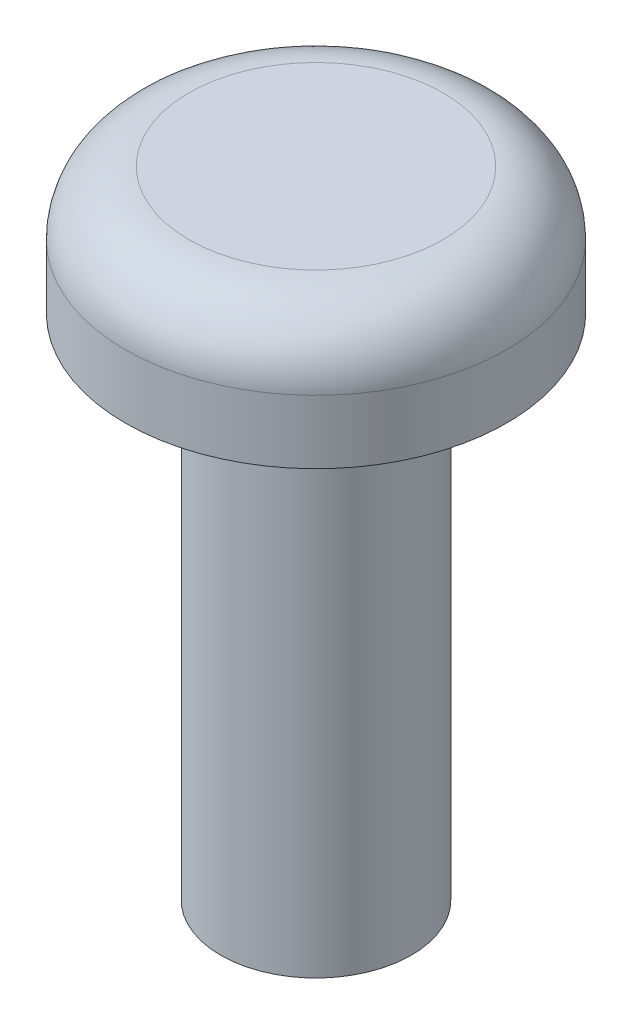
from build123d import *

# Parameters (mm, degrees)
SKETCH1_R           = 1.5
BOSS_EXTRUDE1_DEPTH = 8
SKETCH2_R           = 3
BOSS_EXTRUDE2_DEPTH = 2
FILLET1_R           = 1


with BuildPart() as part:
    # Sketch1 → Boss-Extrude1 (new body)
    with BuildSketch(Plane(origin=(0, 0, 0), x_dir=(1, 0, 0), z_dir=(0, 1, 0))):
        with Locations(Location((0, 0, 0), (0, 0, 270))):
            Circle(SKETCH1_R)
    extrude(amount=BOSS_EXTRUDE1_DEPTH)

    # Sketch2 → Boss-Extrude2 (add)
    with BuildSketch(Plane(origin=(0, 8, 0), x_dir=(1, 0, 0), z_dir=(0, 1, 0))):
        with Locations(Location((0, 0, 0), (0, 0, 270))):
            Circle(SKETCH2_R)
    extrude(amount=BOSS_EXTRUDE2_DEPTH)

    # Fillet1
    fillet1_edges = [part.edges().sort_by_distance(p)[0] for p in [
        (0, 10, -3),
    ]]
    fillet(fillet1_edges, radius=FILLET1_R)


solid = part.part
